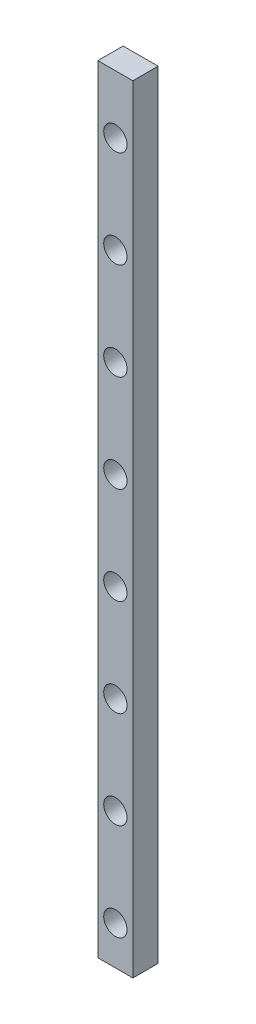
from build123d import *

# Parameters (mm, degrees)
SKETCH_1_W             = 9
SKETCH_1_H             = 6.5
EXTRUDE_1_DEPTH        = 200
SKETCH_2_R             = 3
CUT_EXTRUDE_1_DEPTH    = 4.5
SKETCH_3_R             = 1.75
CUT_EXTRUDE_2_DEPTH    = 4.5
PATTERN_LINEAR_1_COUNT = 8
PATTERN_LINEAR_1_PITCH = 25


with BuildPart() as part:
    # 草图1 → 凸台-拉伸1 (new body)
    with BuildSketch(Plane(origin=(0, 0, 0), x_dir=(1, 0, 0), z_dir=(0, 1, 0))):
        Rectangle(SKETCH_1_W, SKETCH_1_H)
    extrude(amount=EXTRUDE_1_DEPTH)

    # 草图2 → 切除-拉伸1 (cut)
    with BuildSketch(Plane.XY.offset(3.25)):
        with Locations((0, 10)):
            Circle(SKETCH_2_R)
    cut_extrude_1 = extrude(amount=-CUT_EXTRUDE_1_DEPTH, mode=Mode.SUBTRACT)

    # 草图3 → 切除-拉伸2 (cut)
    with BuildSketch(Plane.XY.offset(-1.25)):
        with Locations((0, 10)):
            Circle(SKETCH_3_R)
    cut_extrude_2 = extrude(amount=-CUT_EXTRUDE_2_DEPTH, mode=Mode.SUBTRACT)

    # 阵列(线性)1: 切除-拉伸1, 切除-拉伸2 ×8
    with Locations(*[(0, i * PATTERN_LINEAR_1_PITCH, 0) for i in range(1, PATTERN_LINEAR_1_COUNT)]):
        add(cut_extrude_1, mode=Mode.SUBTRACT)
        add(cut_extrude_2, mode=Mode.SUBTRACT)


solid = part.part
